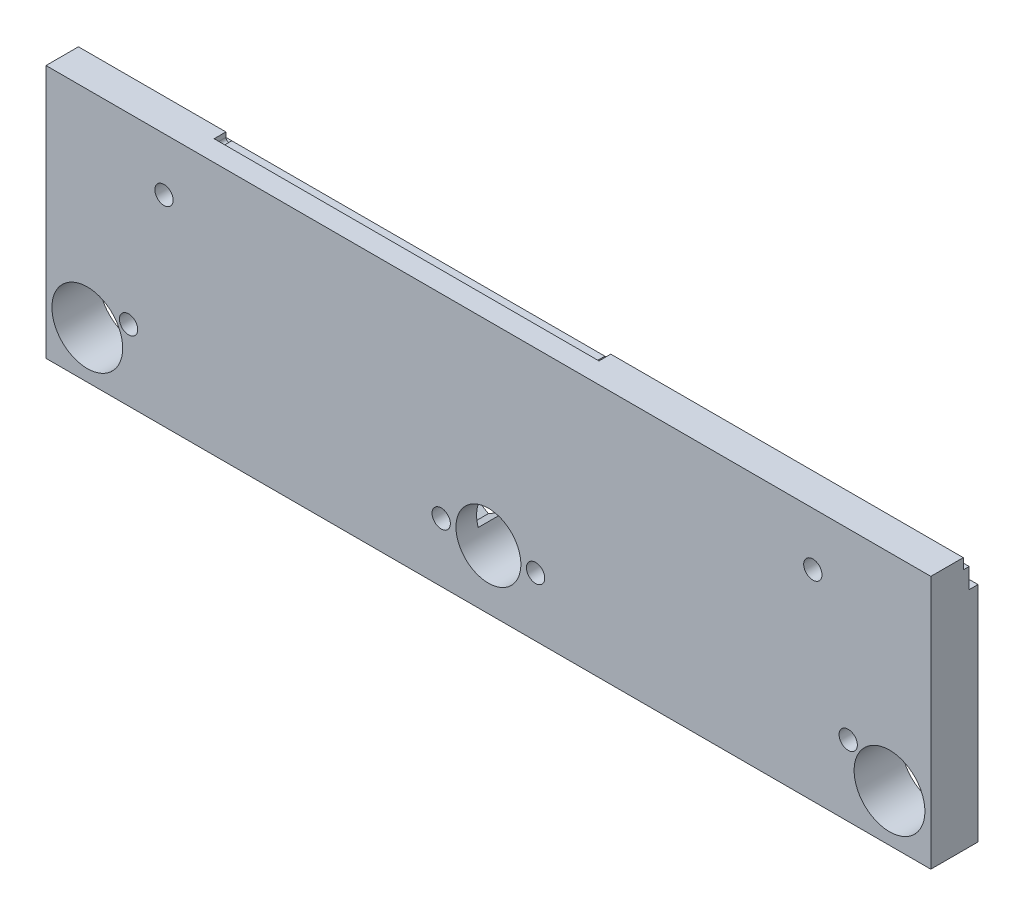
from build123d import *

# Parameters (mm, degrees)
SKETCH_2_W           = 150
SKETCH_2_H           = 43
SKETCH_2_R           = 6
SKETCH_2_R_2         = 4.05
EXTRUDE_1_DEPTH      = 8
CUT_EXTRUDE_2_DEPTH  = 157.246599963
SKETCH_5_R           = 1.55
CUT_EXTRUDE_3_DEPTH  = 157.246599963
CUT_EXTRUDE_5_DEPTH  = 4.5
SKETCH_11_R          = 1.55
CUT_EXTRUDE_7_DEPTH  = 157.246599963
CUT_EXTRUDE_11_DEPTH = 2
SKETCH_22_R          = 1.55
CUT_EXTRUDE_13_DEPTH = 157.246599963
SKETCH_20_R          = 5.5
CUT_EXTRUDE_14_DEPTH = 157.246599963


with BuildPart() as part:
    # 草图2 → 凸台-拉伸1 (new body)
    with BuildSketch(Plane.XY):
        with Locations((75, 21.5)):
            Rectangle(SKETCH_2_W, SKETCH_2_H)
        with Locations((7, 8)):
            Circle(SKETCH_2_R, mode=Mode.SUBTRACT)
        with Locations((75, 10)):
            Circle(SKETCH_2_R_2, mode=Mode.SUBTRACT)
        with Locations((143, 8)):
            Circle(SKETCH_2_R, mode=Mode.SUBTRACT)
    extrude(amount=EXTRUDE_1_DEPTH)

    # 草图4 → 切除-拉伸2 (cut, through all)
    with BuildSketch(Plane(origin=(150, 0, 0), x_dir=(0, 0, -1), z_dir=(1, 0, 0))):
        Polygon((-1.5, 41.2), (-2.5, 41.2), (-2.5, 43), (0, 43), (0, 37.8), (-1.5, 37.8), align=None)
    extrude(amount=-CUT_EXTRUDE_2_DEPTH, mode=Mode.SUBTRACT)

    # 草图5 → 切除-拉伸3 (cut, through all)
    with BuildSketch(Plane.XY.offset(8)):
        with Locations((83, 10)):
            Circle(SKETCH_5_R)
        with Locations((67, 10)):
            Circle(SKETCH_5_R)
    extrude(amount=-CUT_EXTRUDE_3_DEPTH, mode=Mode.SUBTRACT)

    # 草图8 → 切除-拉伸5 (cut)
    with BuildSketch(Plane(origin=(0, 0, 0), x_dir=(-1, 0, 0), z_dir=(0, 0, -1))):
        Polygon((-80.15, 8.354551733), (-80.15, 11.645448267), (-83, 13.290896534), (-85.85, 11.645448267), (-85.85, 8.354551733), (-83, 6.709103466), align=None)
        Polygon((-69.85, 8.354551733), (-67, 6.709103466), (-64.15, 8.354551733), (-64.15, 11.645448267), (-67, 13.290896534), (-69.85, 11.645448267), align=None)
    extrude(amount=-CUT_EXTRUDE_5_DEPTH, mode=Mode.SUBTRACT)

    # 草图11 → 切除-拉伸7 (cut, through all)
    with BuildSketch(Plane(origin=(0, 0, 0), x_dir=(-1, 0, 0), z_dir=(0, 0, -1))):
        with Locations((-130, 34)):
            Circle(SKETCH_11_R)
        with Locations((-20, 34)):
            Circle(SKETCH_11_R)
    extrude(amount=-CUT_EXTRUDE_7_DEPTH, mode=Mode.SUBTRACT)

    # 草图19 → 切除-拉伸11 (cut)
    with BuildSketch(Plane(origin=(0, 0, 2.5), x_dir=(-1, 0, 0), z_dir=(0, 0, -1))):
        with BuildLine():
            Line((-25, 43), (-90.247938178, 43))
            Line((-90.247938178, 43), (-90.247938178, 42.2))
            ThreePointArc((-90.247938178, 42.2), (-89.747938178, 41.7), (-89.247938178, 42.2))
            Line((-89.247938178, 42.2), (-26, 42.2))
            ThreePointArc((-26, 42.2), (-25.5, 41.7), (-25, 42.2))
            Line((-25, 42.2), (-25, 43))
        make_face()
    extrude(amount=-CUT_EXTRUDE_11_DEPTH, mode=Mode.SUBTRACT)

    # 草图22 → 切除-拉伸13 (cut, through all)
    with BuildSketch(Plane(origin=(0, 0, 0), x_dir=(-1, 0, 0), z_dir=(0, 0, -1))):
        with Locations((-136, 12.000000001)):
            Circle(SKETCH_22_R)
        with Locations(Location((-14, 12.000000001, 0), (0, 0, 180))):
            Circle(SKETCH_22_R)
    extrude(amount=-CUT_EXTRUDE_13_DEPTH, mode=Mode.SUBTRACT)

    # 草图20 → 切除-拉伸14 (cut, through all)
    with BuildSketch(Plane(origin=(0, 0, 0), x_dir=(-1, 0, 0), z_dir=(0, 0, -1))):
        with Locations((-75, 10)):
            Circle(SKETCH_20_R)
    extrude(amount=-CUT_EXTRUDE_14_DEPTH, mode=Mode.SUBTRACT)


solid = part.part
